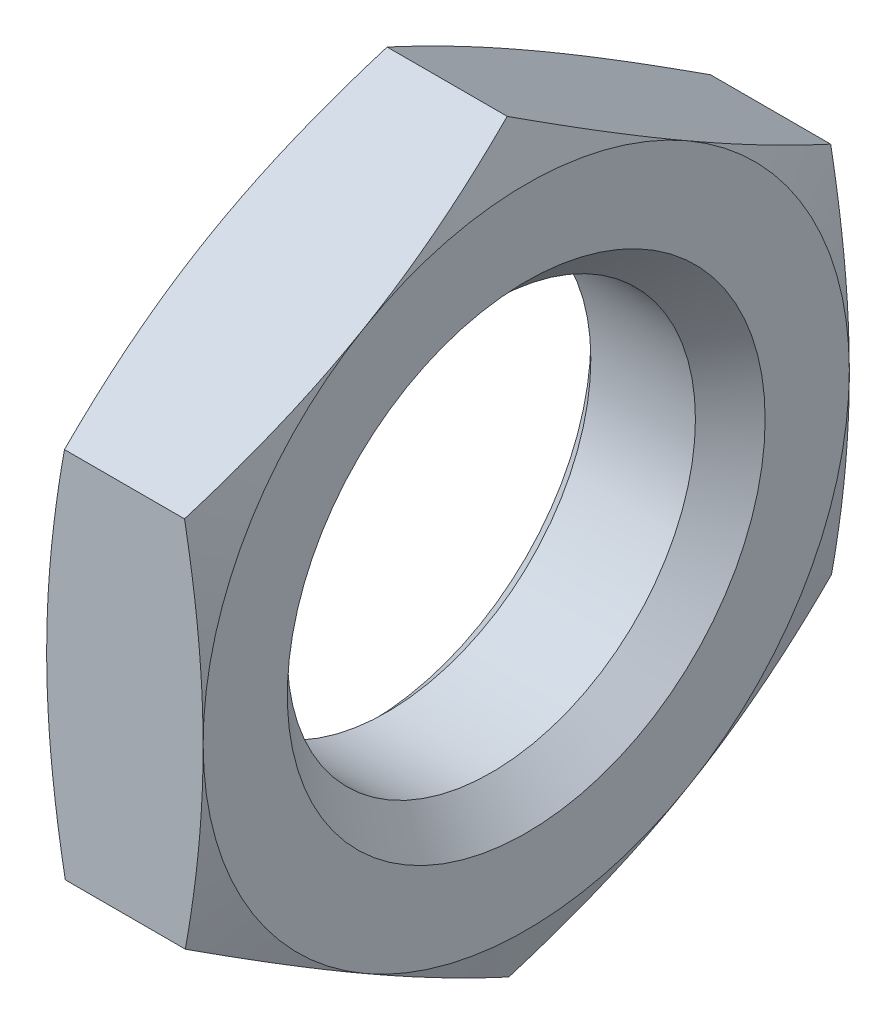
from build123d import *

# Parameters (mm, degrees)
RESSALTO_EXTRUS_O1_DEPTH = 4.6
CHANFRO1_SIZE            = 0.5
ESBO_O8_OUTSIDE_W        = 98.338
ESBO_O8_OUTSIDE_H        = 101.254
ESBO_O8_OUTSIDE_R        = 9.5
CORTE_EXTRUS_O1_DEPTH    = 13
CORTE_EXTRUS_O1_DRAFT    = -70
ESBO_O9_OUTSIDE_W        = 98.338
ESBO_O9_OUTSIDE_H        = 101.254
ESBO_O9_OUTSIDE_R        = 9.5
CORTE_EXTRUS_O2_DEPTH    = 13
CORTE_EXTRUS_O2_DRAFT    = -70


with BuildPart() as part:
    # Esboço1 → Ressalto-extrusão1 (new body)
    with BuildSketch(Plane(origin=(0, 0, 0), x_dir=(0, 0, -1), z_dir=(1, 0, 0))):
        Polygon((9.487887431, 5.505753848), (-0.024178983, 10.969628467), (-9.512066414, 5.46387462), (-9.487887431, -5.505753848), (0.024178983, -10.969628467), (9.512066414, -5.46387462), align=None)
    extrude(amount=RESSALTO_EXTRUS_O1_DEPTH)

    # Esboço6 → Furo roscado de M141 (revolve, cut)
    with BuildSketch(Plane(origin=(4.6, 0, 0), x_dir=(0, 0, -1), z_dir=(0, 1, 0))):
        Polygon((0, 0), (0, 4.6), (6, 4.6), (6, 1.025), (7.025, 0), align=None)
    revolve(axis=Axis((10.95, 0, 0), (-1, 0, 0)), mode=Mode.SUBTRACT)

    # Chanfro1
    chanfro1_edges = [part.edges().sort_by_distance(p)[0] for p in [
        (0, 0, 6),
    ]]
    chamfer(chanfro1_edges, length=CHANFRO1_SIZE)


with BuildPart() as corte_extrus_o1_tool:
    # Esboço8 outside → Corte-extrusão1 (with draft: the straight prism first)
    with BuildSketch(Plane.ZY):
        Rectangle(ESBO_O8_OUTSIDE_W, ESBO_O8_OUTSIDE_H)
        Circle(ESBO_O8_OUTSIDE_R, mode=Mode.SUBTRACT)
    extrude(amount=-CORTE_EXTRUS_O1_DEPTH)
    # Corte-extrusão1: the draft: its side faces are tilted about the plane it starts from
    corte_extrus_o1_sides = [corte_extrus_o1_tool.faces().sort_by_distance(p)[0] for p in [
        (6.5, -50.627, 0),
        (6.5, 0, 49.169),
        (6.5, 50.627, 0),
        (6.5, 0, -49.169),
        (6.5, 0, -9.5),
    ]]
    draft(corte_extrus_o1_sides, Plane.ZY, CORTE_EXTRUS_O1_DRAFT)


with BuildPart() as part_1:
    add(part.part)

    # Corte-extrusão1: cut by corte_extrus_o1_tool
    add(corte_extrus_o1_tool.part, mode=Mode.SUBTRACT)


with BuildPart() as corte_extrus_o2_tool:
    # Esboço9 outside → Corte-extrusão2 (with draft: the straight prism first)
    with BuildSketch(Plane(origin=(4.6, 0, 0), x_dir=(0, 0, -1), z_dir=(1, 0, 0))):
        Rectangle(ESBO_O9_OUTSIDE_W, ESBO_O9_OUTSIDE_H)
        Circle(ESBO_O9_OUTSIDE_R, mode=Mode.SUBTRACT)
    extrude(amount=-CORTE_EXTRUS_O2_DEPTH)
    # Corte-extrusão2: the draft: its side faces are tilted about the plane it starts from
    corte_extrus_o2_sides = [corte_extrus_o2_tool.faces().sort_by_distance(p)[0] for p in [
        (-1.9, -50.627, 0),
        (-1.9, 0, -49.169),
        (-1.9, 50.627, 0),
        (-1.9, 0, 49.169),
        (-1.9, 0, 9.5),
    ]]
    draft(corte_extrus_o2_sides, Plane(origin=(4.6, 0, 0), x_dir=(0, 0, -1), z_dir=(1, 0, 0)), CORTE_EXTRUS_O2_DRAFT)


with BuildPart() as part_2:
    add(part_1.part)

    # Corte-extrusão2: cut by corte_extrus_o2_tool
    add(corte_extrus_o2_tool.part, mode=Mode.SUBTRACT)


solid = part_2.part
